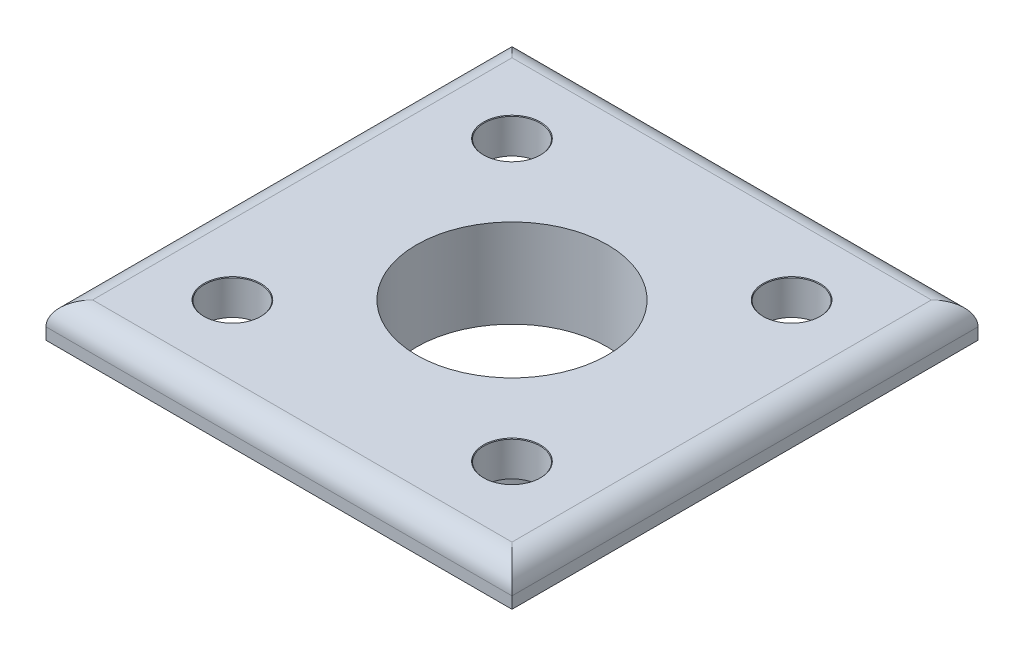
from build123d import *

# Parameters (mm, degrees)
SKETCH1_W                      = 20
SKETCH1_H                      = 20
BOSS_EXTRUDE1_DEPTH            = 1.5
M2_CLEARANCE_HOLE1_D           = 2.4
M2_CLEARANCE_HOLE1_CSINK_D     = 2.45
M2_CLEARANCE_HOLE1_CSINK_ANGLE = 90
FILLET1_R                      = 1
CUT_EXTRUDE1_REACH             = 16.221
SKETCH2_R                      = 4.1
SKETCH6_R                      = 5.45
SKETCH6_R_2                    = 4.1
BOSS_EXTRUDE2_DEPTH            = 2.3
CHAMFER1_SIZE                  = 0.5


with BuildPart() as part:
    # Sketch1 → Boss-Extrude1 (new body)
    with BuildSketch(Plane(origin=(0, 0, 0), x_dir=(1, 0, 0), z_dir=(0, 1, 0))):
        Rectangle(SKETCH1_W, SKETCH1_H)
    extrude(amount=BOSS_EXTRUDE1_DEPTH)

    # M2 Clearance Hole1 (through all)
    with Locations(Plane(origin=(0, 1.5, 0), x_dir=(1, 0, 0), z_dir=(0, 1, 0))):
        with Locations((-6, 6), (6, 6), (-6, -6), (6, -6)):
            CounterSinkHole(M2_CLEARANCE_HOLE1_D / 2, M2_CLEARANCE_HOLE1_CSINK_D / 2, counter_sink_angle=M2_CLEARANCE_HOLE1_CSINK_ANGLE)

    # Fillet1
    fillet1_edges = [part.edges().sort_by_distance(p)[0] for p in [
        (-10, 1.5, 0),
        (0, 1.5, 10),
        (10, 1.5, 0),
        (0, 1.5, -10),
    ]]
    fillet(fillet1_edges, radius=FILLET1_R)

    # Sketch2 → Cut-Extrude1 (cut, up to next)
    with BuildSketch(Plane(origin=(0, 1.5, 0), x_dir=(1, 0, 0), z_dir=(0, 1, 0)), mode=Mode.PRIVATE) as cut_extrude1_sk1:
        with Locations(Location((0, 0, 0), (0, 0, 270))):
            Circle(SKETCH2_R)
    cut_extrude1_tool1 = extrude(cut_extrude1_sk1.sketch, amount=-CUT_EXTRUDE1_REACH, mode=Mode.PRIVATE) & part.part
    add(cut_extrude1_tool1.solids().sort_by_distance((0, 1.5, 0))[0], mode=Mode.SUBTRACT)

    # Sketch6 → Boss-Extrude2 (add)
    with BuildSketch(Plane.XZ):
        with Locations(Location((0, 0, 0), (0, 0, 270))):
            Circle(SKETCH6_R)
        with Locations(Location((0, 0, 0), (0, 0, 90))):
            Circle(SKETCH6_R_2, mode=Mode.SUBTRACT)
    extrude(amount=BOSS_EXTRUDE2_DEPTH)

    # Chamfer1
    chamfer1_edges = [part.edges().sort_by_distance(p)[0] for p in [
        (0, -2.3, 5.45),
    ]]
    chamfer(chamfer1_edges, length=CHAMFER1_SIZE)


solid = part.part
